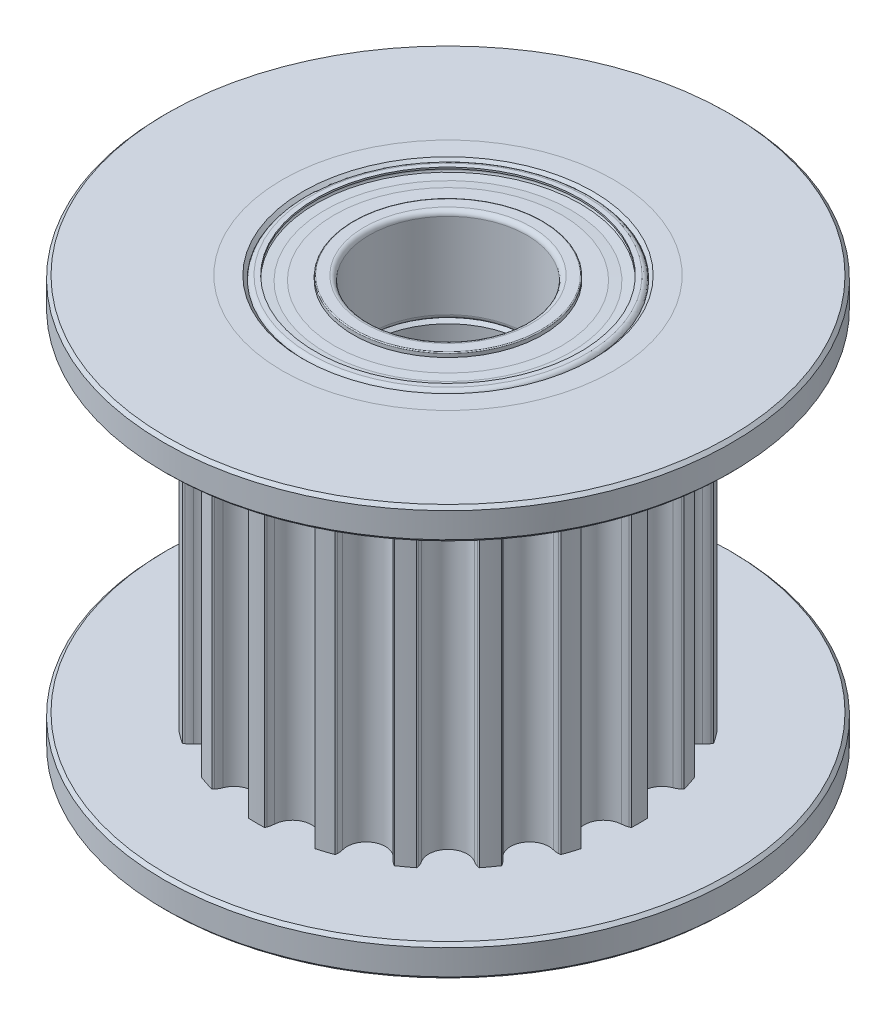
from build123d import *

# Parameters (mm, degrees)
ZKOSEN_1_SIZE            = 0.1
ZAOBLIT1_R               = 0.1
SKICA11_OUTSIDE_W        = 18.46
SKICA11_OUTSIDE_H        = 18.46
ODEBRAT_VYSUNUT_M1_DEPTH = 15.758429795
SKICA10_R                = 9
SKICA10_R_2              = 5.25
P_IDAT_VYSUNUT_M1_DEPTH  = 1
SKICA12_R                = 9
SKICA12_R_2              = 5.25
P_IDAT_VYSUNUT_M2_DEPTH  = 1
ZKOSEN_2_SIZE            = 0.1
ZKOSEN_3_SIZE            = 0.1
KRUHOV_POLE1_COUNT       = 8
KRUHOV_POLE3_COUNT       = 8


with BuildPart() as part:
    # Skica1 → Rotovat1 (revolve)
    with BuildSketch(Plane.XY, mode=Mode.PRIVATE) as rotovat1_sk:
        Polygon((4.5, 13), (5.25, 13), (5.25, 12), (6.075, 12), (6.075, 1), (5.25, 1), (5.25, 0), (4.5, 0), (4.5, 3), (2.5, 3), (2.5, 10), (4.5, 10), align=None)
    revolve(rotovat1_sk.sketch.rotate(Axis((0, 0, 0), (0, -1, 0)), 90), axis=Axis((0, 0, 0), (0, -1, 0)))

    # Zkosení1
    zkosen_1_edges = [part.edges().sort_by_distance(p)[0] for p in [
        (0, 3, -2.5),
        (0, 0, -4.5),
        (0, 13, -4.5),
        (0, 10, -2.5),
    ]]
    chamfer(zkosen_1_edges, length=ZKOSEN_1_SIZE)

    # Zaoblit1
    zaoblit1_edges = [part.edges().sort_by_distance(p)[0] for p in [
        (0, 3, -4.5),
        (0, 10, -4.5),
    ]]
    fillet(zaoblit1_edges, radius=ZAOBLIT1_R)

    # Skica11 outside → Odebrat vysunutím1 (cut, through all)
    with BuildSketch(Plane(origin=(0, 12, 0), x_dir=(1, 0, 0), z_dir=(0, 1, 0))):
        Rectangle(SKICA11_OUTSIDE_W, SKICA11_OUTSIDE_H)
        with BuildLine():
            ThreePointArc((-3.682382953, -4.525571141), (-3.762727315, -3.762727315), (-4.525571141, -3.682382953))
            ThreePointArc((-4.525571141, -3.682382953), (-4.610021183, -3.728793285), (-4.700326133, -3.762419831))
            ThreePointArc((-4.700326133, -3.762419831), (-4.754288274, -3.771323603), (-4.808820948, -3.767154999))
            ThreePointArc((-4.808820948, -3.767154999), (-4.942042114, -3.590603771), (-5.068784705, -3.409345583))
            ThreePointArc((-5.068784705, -3.409345583), (-5.05589776, -3.356193758), (-5.030754552, -3.307624129))
            ThreePointArc((-5.030754552, -3.307624129), (-4.970868041, -3.232130193), (-4.900632695, -3.166155011))
            ThreePointArc((-4.900632695, -3.166155011), (-4.741313017, -2.415819646), (-5.441992836, -2.103675911))
            ThreePointArc((-5.441992836, -2.103675911), (-5.53665118, -2.121718261), (-5.632927465, -2.125793243))
            ThreePointArc((-5.632927465, -2.125793243), (-5.686999927, -2.117586015), (-5.737575413, -2.096769914))
            ThreePointArc((-5.737575413, -2.096769914), (-5.809718941, -1.887692114), (-5.874246448, -1.676139718))
            ThreePointArc((-5.874246448, -1.676139718), (-5.845565418, -1.629571614), (-5.806643965, -1.591148831))
            ThreePointArc((-5.806643965, -1.591148831), (-5.7263596, -1.53785578), (-5.639174364, -1.496813569))
            ThreePointArc((-5.639174364, -1.496813569), (-5.255785967, -0.832434719), (-5.825714356, -0.319046414))
            ThreePointArc((-5.825714356, -0.319046414), (-5.921315183, -0.306954671), (-6.01413861, -0.281079202))
            ThreePointArc((-6.01413861, -0.281079202), (-6.063028405, -0.256564354), (-6.104696021, -0.221138381))
            ThreePointArc((-6.104696021, -0.221138381), (-6.1087, 0), (-6.104696021, 0.221138381))
            ThreePointArc((-6.104696021, 0.221138381), (-6.063028405, 0.256564354), (-6.01413861, 0.281079202))
            ThreePointArc((-6.01413861, 0.281079202), (-5.921315183, 0.306954671), (-5.825714356, 0.319046414))
            ThreePointArc((-5.825714356, 0.319046414), (-5.255785967, 0.832434719), (-5.639174364, 1.496813569))
            ThreePointArc((-5.639174364, 1.496813569), (-5.7263596, 1.53785578), (-5.806643965, 1.591148831))
            ThreePointArc((-5.806643965, 1.591148831), (-5.845565418, 1.629571614), (-5.874246448, 1.676139718))
            ThreePointArc((-5.874246448, 1.676139718), (-5.809718941, 1.887692114), (-5.737575413, 2.096769914))
            ThreePointArc((-5.737575413, 2.096769914), (-5.686999927, 2.117586015), (-5.632927465, 2.125793243))
            ThreePointArc((-5.632927465, 2.125793243), (-5.53665118, 2.121718261), (-5.441992836, 2.103675911))
            ThreePointArc((-5.441992836, 2.103675911), (-4.741313017, 2.415819646), (-4.900632695, 3.166155011))
            ThreePointArc((-4.900632695, 3.166155011), (-4.970868041, 3.232130193), (-5.030754552, 3.307624129))
            ThreePointArc((-5.030754552, 3.307624129), (-5.05589776, 3.356193758), (-5.068784705, 3.409345583))
            ThreePointArc((-5.068784705, 3.409345583), (-4.942042114, 3.590603771), (-4.808820948, 3.767154999))
            ThreePointArc((-4.808820948, 3.767154999), (-4.754288274, 3.771323603), (-4.700326133, 3.762419831))
            ThreePointArc((-4.700326133, 3.762419831), (-4.610021183, 3.728793285), (-4.525571141, 3.682382953))
            ThreePointArc((-4.525571141, 3.682382953), (-3.762727315, 3.762727315), (-3.682382953, 4.525571141))
            ThreePointArc((-3.682382953, 4.525571141), (-3.728793285, 4.610021183), (-3.762419831, 4.700326133))
            ThreePointArc((-3.762419831, 4.700326133), (-3.771323603, 4.754288274), (-3.767154999, 4.808820948))
            ThreePointArc((-3.767154999, 4.808820948), (-3.590603771, 4.942042114), (-3.409345583, 5.068784705))
            ThreePointArc((-3.409345583, 5.068784705), (-3.356193758, 5.05589776), (-3.307624129, 5.030754552))
            ThreePointArc((-3.307624129, 5.030754552), (-3.232130193, 4.970868041), (-3.166155011, 4.900632695))
            ThreePointArc((-3.166155011, 4.900632695), (-2.415819646, 4.741313017), (-2.103675911, 5.441992836))
            ThreePointArc((-2.103675911, 5.441992836), (-2.121718261, 5.53665118), (-2.125793243, 5.632927465))
            ThreePointArc((-2.125793243, 5.632927465), (-2.117586015, 5.686999927), (-2.096769914, 5.737575413))
            ThreePointArc((-2.096769914, 5.737575413), (-1.887692114, 5.809718941), (-1.676139718, 5.874246448))
            ThreePointArc((-1.676139718, 5.874246448), (-1.629571614, 5.845565418), (-1.591148831, 5.806643965))
            ThreePointArc((-1.591148831, 5.806643965), (-1.53785578, 5.7263596), (-1.496813569, 5.639174364))
            ThreePointArc((-1.496813569, 5.639174364), (-0.832434719, 5.255785967), (-0.319046414, 5.825714356))
            ThreePointArc((-0.319046414, 5.825714356), (-0.306954671, 5.921315183), (-0.281079202, 6.01413861))
            ThreePointArc((-0.281079202, 6.01413861), (-0.256564354, 6.063028405), (-0.221138381, 6.104696021))
            ThreePointArc((-0.221138381, 6.104696021), (0, 6.1087), (0.221138381, 6.104696021))
            ThreePointArc((0.221138381, 6.104696021), (0.256564354, 6.063028405), (0.281079202, 6.01413861))
            ThreePointArc((0.281079202, 6.01413861), (0.306954671, 5.921315183), (0.319046414, 5.825714356))
            ThreePointArc((0.319046414, 5.825714356), (0.832434719, 5.255785967), (1.496813569, 5.639174364))
            ThreePointArc((1.496813569, 5.639174364), (1.53785578, 5.7263596), (1.591148831, 5.806643965))
            ThreePointArc((1.591148831, 5.806643965), (1.629571614, 5.845565418), (1.676139718, 5.874246448))
            ThreePointArc((1.676139718, 5.874246448), (1.887692114, 5.809718941), (2.096769914, 5.737575413))
            ThreePointArc((2.096769914, 5.737575413), (2.117586015, 5.686999927), (2.125793243, 5.632927465))
            ThreePointArc((2.125793243, 5.632927465), (2.121718261, 5.53665118), (2.103675911, 5.441992836))
            ThreePointArc((2.103675911, 5.441992836), (2.415819646, 4.741313017), (3.166155011, 4.900632695))
            ThreePointArc((3.166155011, 4.900632695), (3.232130193, 4.970868041), (3.307624129, 5.030754552))
            ThreePointArc((3.307624129, 5.030754552), (3.356193758, 5.05589776), (3.409345583, 5.068784705))
            ThreePointArc((3.409345583, 5.068784705), (3.590603771, 4.942042114), (3.767154999, 4.808820948))
            ThreePointArc((3.767154999, 4.808820948), (3.771323603, 4.754288274), (3.762419831, 4.700326133))
            ThreePointArc((3.762419831, 4.700326133), (3.728793285, 4.610021183), (3.682382953, 4.525571141))
            ThreePointArc((3.682382953, 4.525571141), (3.762727315, 3.762727315), (4.525571141, 3.682382953))
            ThreePointArc((4.525571141, 3.682382953), (4.610021183, 3.728793285), (4.700326133, 3.762419831))
            ThreePointArc((4.700326133, 3.762419831), (4.754288273, 3.771323603), (4.808820948, 3.767154999))
            ThreePointArc((4.808820948, 3.767154999), (4.942042114, 3.590603771), (5.068784705, 3.409345583))
            ThreePointArc((5.068784705, 3.409345583), (5.05589776, 3.356193758), (5.030754552, 3.307624129))
            ThreePointArc((5.030754552, 3.307624129), (4.970868041, 3.232130193), (4.900632695, 3.166155011))
            ThreePointArc((4.900632695, 3.166155011), (4.741313017, 2.415819646), (5.441992836, 2.103675911))
            ThreePointArc((5.441992836, 2.103675911), (5.53665118, 2.121718261), (5.632927465, 2.125793243))
            ThreePointArc((5.632927465, 2.125793243), (5.686999927, 2.117586015), (5.737575413, 2.096769914))
            ThreePointArc((5.737575413, 2.096769914), (5.809718941, 1.887692114), (5.874246448, 1.676139718))
            ThreePointArc((5.874246448, 1.676139718), (5.845565418, 1.629571614), (5.806643965, 1.591148831))
            ThreePointArc((5.806643965, 1.591148831), (5.7263596, 1.53785578), (5.639174364, 1.496813569))
            ThreePointArc((5.639174364, 1.496813569), (5.255785967, 0.832434719), (5.825714356, 0.319046414))
            ThreePointArc((5.825714356, 0.319046414), (5.921315183, 0.306954671), (6.01413861, 0.281079202))
            ThreePointArc((6.01413861, 0.281079202), (6.063028405, 0.256564354), (6.104696021, 0.221138381))
            ThreePointArc((6.104696021, 0.221138381), (6.1087, 0), (6.104696021, -0.221138381))
            ThreePointArc((6.104696021, -0.221138381), (6.063028405, -0.256564354), (6.01413861, -0.281079202))
            ThreePointArc((6.01413861, -0.281079202), (5.921315183, -0.306954671), (5.825714356, -0.319046414))
            ThreePointArc((5.825714356, -0.319046414), (5.255785967, -0.832434719), (5.639174364, -1.496813569))
            ThreePointArc((5.639174364, -1.496813569), (5.7263596, -1.53785578), (5.806643965, -1.591148831))
            ThreePointArc((5.806643965, -1.591148831), (5.845565418, -1.629571614), (5.874246448, -1.676139718))
            ThreePointArc((5.874246448, -1.676139718), (5.809718941, -1.887692114), (5.737575413, -2.096769914))
            ThreePointArc((5.737575413, -2.096769914), (5.686999927, -2.117586015), (5.632927465, -2.125793243))
            ThreePointArc((5.632927465, -2.125793243), (5.53665118, -2.121718261), (5.441992836, -2.103675911))
            ThreePointArc((5.441992836, -2.103675911), (4.741313017, -2.415819646), (4.900632695, -3.166155011))
            ThreePointArc((4.900632695, -3.166155011), (4.970868041, -3.232130193), (5.030754552, -3.307624129))
            ThreePointArc((5.030754552, -3.307624129), (5.05589776, -3.356193758), (5.068784705, -3.409345583))
            ThreePointArc((5.068784705, -3.409345583), (4.942042114, -3.590603771), (4.808820948, -3.767154999))
            ThreePointArc((4.808820948, -3.767154999), (4.754288273, -3.771323603), (4.700326133, -3.762419831))
            ThreePointArc((4.700326133, -3.762419831), (4.610021183, -3.728793285), (4.525571141, -3.682382953))
            ThreePointArc((4.525571141, -3.682382953), (3.762727315, -3.762727315), (3.682382953, -4.525571141))
            ThreePointArc((3.682382953, -4.525571141), (3.728793285, -4.610021183), (3.762419831, -4.700326133))
            ThreePointArc((3.762419831, -4.700326133), (3.771323603, -4.754288274), (3.767154999, -4.808820948))
            ThreePointArc((3.767154999, -4.808820948), (3.590603771, -4.942042114), (3.409345583, -5.068784705))
            ThreePointArc((3.409345583, -5.068784705), (3.356193758, -5.05589776), (3.307624129, -5.030754552))
            ThreePointArc((3.307624129, -5.030754552), (3.232130193, -4.970868041), (3.166155011, -4.900632695))
            ThreePointArc((3.166155011, -4.900632695), (2.415819646, -4.741313017), (2.103675911, -5.441992836))
            ThreePointArc((2.103675911, -5.441992836), (2.121718261, -5.53665118), (2.125793243, -5.632927465))
            ThreePointArc((2.125793243, -5.632927465), (2.117586015, -5.686999927), (2.096769914, -5.737575413))
            ThreePointArc((2.096769914, -5.737575413), (1.887692114, -5.809718941), (1.676139718, -5.874246448))
            ThreePointArc((1.676139718, -5.874246448), (1.629571614, -5.845565418), (1.591148831, -5.806643965))
            ThreePointArc((1.591148831, -5.806643965), (1.53785578, -5.7263596), (1.496813569, -5.639174364))
            ThreePointArc((1.496813569, -5.639174364), (0.832434719, -5.255785967), (0.319046414, -5.825714356))
            ThreePointArc((0.319046414, -5.825714356), (0.306954671, -5.921315183), (0.281079202, -6.01413861))
            ThreePointArc((0.281079202, -6.01413861), (0.256564354, -6.063028405), (0.221138381, -6.104696021))
            ThreePointArc((0.221138381, -6.104696021), (0, -6.1087), (-0.221138381, -6.104696021))
            ThreePointArc((-0.221138381, -6.104696021), (-0.256564354, -6.063028405), (-0.281079202, -6.01413861))
            ThreePointArc((-0.281079202, -6.01413861), (-0.306954671, -5.921315183), (-0.319046414, -5.825714356))
            ThreePointArc((-0.319046414, -5.825714356), (-0.832434719, -5.255785967), (-1.496813569, -5.639174364))
            ThreePointArc((-1.496813569, -5.639174364), (-1.53785578, -5.7263596), (-1.591148831, -5.806643965))
            ThreePointArc((-1.591148831, -5.806643965), (-1.629571614, -5.845565418), (-1.676139718, -5.874246448))
            ThreePointArc((-1.676139718, -5.874246448), (-1.887692114, -5.809718941), (-2.096769914, -5.737575413))
            ThreePointArc((-2.096769914, -5.737575413), (-2.117586015, -5.686999927), (-2.125793243, -5.632927465))
            ThreePointArc((-2.125793243, -5.632927465), (-2.121718261, -5.53665118), (-2.103675911, -5.441992836))
            ThreePointArc((-2.103675911, -5.441992836), (-2.415819646, -4.741313017), (-3.166155011, -4.900632695))
            ThreePointArc((-3.166155011, -4.900632695), (-3.232130193, -4.970868041), (-3.307624129, -5.030754552))
            ThreePointArc((-3.307624129, -5.030754552), (-3.356193758, -5.05589776), (-3.409345583, -5.068784705))
            ThreePointArc((-3.409345583, -5.068784705), (-3.590603771, -4.942042114), (-3.767154999, -4.808820948))
            ThreePointArc((-3.767154999, -4.808820948), (-3.771323603, -4.754288274), (-3.762419831, -4.700326133))
            ThreePointArc((-3.762419831, -4.700326133), (-3.728793285, -4.610021183), (-3.682382953, -4.525571141))
        make_face(mode=Mode.SUBTRACT)
    extrude(amount=-ODEBRAT_VYSUNUT_M1_DEPTH, mode=Mode.SUBTRACT)


with BuildPart() as body_2:
    # Skica10 → Přidat vysunutím1 (new body)
    with BuildSketch(Plane(origin=(0, 13, 0), x_dir=(1, 0, 0), z_dir=(0, 1, 0))):
        with Locations(Location((0, 0, 0), (0, 0, 270))):
            Circle(SKICA10_R)
        with Locations(Location((0, 0, 0), (0, 0, 270))):
            Circle(SKICA10_R_2, mode=Mode.SUBTRACT)
    extrude(amount=-P_IDAT_VYSUNUT_M1_DEPTH)

    # Zkosení2
    zkosen_2_edges = [body_2.edges().sort_by_distance(p)[0] for p in [
        (0, 13, -9),
        (0, 12, -9),
    ]]
    chamfer(zkosen_2_edges, length=ZKOSEN_2_SIZE)


with BuildPart() as body_3:
    # Skica12 → Přidat vysunutím2 (new body)
    with BuildSketch(Plane.XZ):
        with Locations(Location((0, 0, 0), (0, 0, 270))):
            Circle(SKICA12_R)
        with Locations(Location((0, 0, 0), (0, 0, 270))):
            Circle(SKICA12_R_2, mode=Mode.SUBTRACT)
    extrude(amount=-P_IDAT_VYSUNUT_M2_DEPTH)

    # Zkosení3
    zkosen_3_edges = [body_3.edges().sort_by_distance(p)[0] for p in [
        (0, 0, 9),
        (0, 1, 9),
    ]]
    chamfer(zkosen_3_edges, length=ZKOSEN_3_SIZE)


with BuildPart() as body_4:
    # Skica4 → Rotovat2 (revolve)
    with BuildSketch(Plane.XY, mode=Mode.PRIVATE) as rotovat2_sk:
        with BuildLine():
            Line((4.5, 12.85), (4.5, 10.15))
            ThreePointArc((4.5, 10.15), (4.456066017, 10.043933983), (4.35, 10))
            Line((4.35, 10), (4.2, 10))
            Line((4.2, 10), (4.2, 10.05))
            ThreePointArc((4.2, 10.05), (4.289757174, 10.133393211), (4.213177928, 10.229030007))
            Line((4.213177928, 10.229030007), (3.85, 10.282786405))
            Line((3.85, 10.282786405), (3.85, 11.052786405))
            ThreePointArc((3.85, 11.052786405), (4.05, 11.5), (3.85, 11.947213595))
            Line((3.85, 11.947213595), (3.85, 12.717213595))
            Line((3.85, 12.717213595), (4.213177928, 12.770969993))
            ThreePointArc((4.213177928, 12.770969993), (4.289757174, 12.866606789), (4.2, 12.95))
            Line((4.2, 12.95), (4.2, 13))
            Line((4.2, 13), (4.35, 13))
            ThreePointArc((4.35, 13), (4.456066017, 12.956066017), (4.5, 12.85))
        make_face()
    revolve(rotovat2_sk.sketch.rotate(Axis((0, 0, 0), (0, 1, 0)), 90), axis=Axis((0, 0, 0), (0, 1, 0)))


with BuildPart() as body_5:
    # Skica5 → Rotovat3 (revolve)
    with BuildSketch(Plane.XY, mode=Mode.PRIVATE) as rotovat3_sk:
        with BuildLine():
            Line((2.5, 12.85), (2.5, 10.15))
            ThreePointArc((2.5, 10.15), (2.543933983, 10.043933983), (2.65, 10))
            Line((2.65, 10), (2.97, 10))
            ThreePointArc((2.97, 10), (2.991213203, 10.008786797), (3, 10.03))
            Line((3, 10.03), (3, 10.14))
            Line((3, 10.14), (3.6, 10.14))
            Line((3.6, 10.14), (3.896185034, 10.191714847))
            Line((3.896185034, 10.191714847), (4.192370069, 10.14))
            Line((4.192370069, 10.14), (4.192370069, 10.19))
            Line((4.192370069, 10.19), (3.897467562, 10.258062558))
            Line((3.897467562, 10.258062558), (3.597467562, 10.258062558))
            Line((3.597467562, 10.258062558), (3, 10.19))
            Line((3, 10.19), (3, 11.103137303))
            ThreePointArc((3, 11.103137303), (2.85, 11.5), (3, 11.896862697))
            Line((3, 11.896862697), (3, 12.81))
            Line((3, 12.81), (3.6, 12.77))
            Line((3.6, 12.77), (3.9, 12.77))
            Line((3.9, 12.77), (4.2, 12.81))
            Line((4.2, 12.81), (4.2, 12.86))
            Line((4.2, 12.86), (3.9, 12.84))
            Line((3.9, 12.84), (3.6, 12.86))
            Line((3.6, 12.86), (3, 12.86))
            Line((3, 12.86), (3, 12.97))
            ThreePointArc((3, 12.97), (2.991213203, 12.991213203), (2.97, 13))
            Line((2.97, 13), (2.65, 13))
            ThreePointArc((2.65, 13), (2.543933983, 12.956066017), (2.5, 12.85))
        make_face()
    revolve(rotovat3_sk.sketch.rotate(Axis((0, 0, 0), (0, 1, 0)), 90), axis=Axis((0, 0, 0), (0, 1, 0)))


with BuildPart() as body_6:
    # Skica6 → Rotovat4 (revolve)
    with BuildSketch(Plane.XY):
        with BuildLine():
            Line((3.45, 12.1), (3.45, 10.9))
            ThreePointArc((3.45, 10.9), (4.05, 11.5), (3.45, 12.1))
        make_face()
    revolve(axis=Axis((3.45, 12.1, 0), (0, -1, 0)))


with BuildPart() as kruhov_pole1_1:
    # Kruhové pole1: pattern copy
    add(body_6.part.rotate(Axis((0, 0, 0), (0, 1, 0)), 1 * 360 / KRUHOV_POLE1_COUNT))


with BuildPart() as kruhov_pole1_2:
    # Kruhové pole1: pattern copy
    add(body_6.part.rotate(Axis((0, 0, 0), (0, 1, 0)), 2 * 360 / KRUHOV_POLE1_COUNT))


with BuildPart() as kruhov_pole1_3:
    # Kruhové pole1: pattern copy
    add(body_6.part.rotate(Axis((0, 0, 0), (0, 1, 0)), 3 * 360 / KRUHOV_POLE1_COUNT))


with BuildPart() as kruhov_pole1_4:
    # Kruhové pole1: pattern copy
    add(body_6.part.rotate(Axis((0, 0, 0), (0, 1, 0)), 4 * 360 / KRUHOV_POLE1_COUNT))


with BuildPart() as kruhov_pole1_5:
    # Kruhové pole1: pattern copy
    add(body_6.part.rotate(Axis((0, 0, 0), (0, 1, 0)), 5 * 360 / KRUHOV_POLE1_COUNT))


with BuildPart() as kruhov_pole1_6:
    # Kruhové pole1: pattern copy
    add(body_6.part.rotate(Axis((0, 0, 0), (0, 1, 0)), 6 * 360 / KRUHOV_POLE1_COUNT))


with BuildPart() as kruhov_pole1_7:
    # Kruhové pole1: pattern copy
    add(body_6.part.rotate(Axis((0, 0, 0), (0, 1, 0)), 7 * 360 / KRUHOV_POLE1_COUNT))


with BuildPart() as body_14:
    # Skica7 → Rotovat5 (revolve)
    with BuildSketch(Plane.XY, mode=Mode.PRIVATE) as rotovat5_sk:
        with BuildLine():
            Line((4.5, 2.85), (4.5, 0.15))
            ThreePointArc((4.5, 0.15), (4.456066017, 0.043933983), (4.35, 0))
            Line((4.35, 0), (4.2, 0))
            Line((4.2, 0), (4.2, 0.05))
            ThreePointArc((4.2, 0.05), (4.289757174, 0.133393211), (4.213177928, 0.229030007))
            Line((4.213177928, 0.229030007), (3.85, 0.282786405))
            Line((3.85, 0.282786405), (3.85, 1.052786405))
            ThreePointArc((3.85, 1.052786405), (4.05, 1.5), (3.85, 1.947213595))
            Line((3.85, 1.947213595), (3.85, 2.717213595))
            Line((3.85, 2.717213595), (4.213177928, 2.770969993))
            ThreePointArc((4.213177928, 2.770969993), (4.289757174, 2.866606789), (4.2, 2.95))
            Line((4.2, 2.95), (4.2, 3))
            Line((4.2, 3), (4.35, 3))
            ThreePointArc((4.35, 3), (4.456066017, 2.956066017), (4.5, 2.85))
        make_face()
    revolve(rotovat5_sk.sketch.rotate(Axis((0, 0, 0), (0, 1, 0)), 90), axis=Axis((0, 0, 0), (0, 1, 0)))


with BuildPart() as body_15:
    # Skica8 → Rotovat6 (revolve)
    with BuildSketch(Plane.XY, mode=Mode.PRIVATE) as rotovat6_sk:
        with BuildLine():
            Line((2.5, 2.85), (2.5, 0.15))
            ThreePointArc((2.5, 0.15), (2.543933983, 0.043933983), (2.65, 0))
            Line((2.65, 0), (2.97, 0))
            ThreePointArc((2.97, 0), (2.991213203, 0.008786797), (3, 0.03))
            Line((3, 0.03), (3, 0.14))
            Line((3, 0.14), (3.6, 0.14))
            Line((3.6, 0.14), (3.896185034, 0.191714847))
            Line((3.896185034, 0.191714847), (4.192370069, 0.14))
            Line((4.192370069, 0.14), (4.192370069, 0.19))
            Line((4.192370069, 0.19), (3.897467562, 0.258062558))
            Line((3.897467562, 0.258062558), (3.597467562, 0.258062558))
            Line((3.597467562, 0.258062558), (3, 0.19))
            Line((3, 0.19), (3, 1.103137303))
            ThreePointArc((3, 1.103137303), (2.85, 1.5), (3, 1.896862697))
            Line((3, 1.896862697), (3, 2.81))
            Line((3, 2.81), (3.6, 2.77))
            Line((3.6, 2.77), (3.9, 2.77))
            Line((3.9, 2.77), (4.2, 2.81))
            Line((4.2, 2.81), (4.2, 2.86))
            Line((4.2, 2.86), (3.9, 2.84))
            Line((3.9, 2.84), (3.6, 2.86))
            Line((3.6, 2.86), (3, 2.86))
            Line((3, 2.86), (3, 2.97))
            ThreePointArc((3, 2.97), (2.991213203, 2.991213203), (2.97, 3))
            Line((2.97, 3), (2.65, 3))
            ThreePointArc((2.65, 3), (2.543933983, 2.956066017), (2.5, 2.85))
        make_face()
    revolve(rotovat6_sk.sketch.rotate(Axis((0, 0, 0), (0, -1, 0)), 180), axis=Axis((0, 0, 0), (0, -1, 0)))


with BuildPart() as body_16:
    # Skica9 → Rotovat7 (revolve)
    with BuildSketch(Plane.XY):
        with BuildLine():
            Line((3.45, 2.1), (3.45, 0.9))
            ThreePointArc((3.45, 0.9), (4.05, 1.5), (3.45, 2.1))
        make_face()
    revolve(axis=Axis((3.45, 2.1, 0), (0, -1, 0)))


with BuildPart() as kruhov_pole3_1:
    # Kruhové pole3: pattern copy
    add(body_16.part.rotate(Axis((0, 0, 0), (0, 1, 0)), 1 * 360 / KRUHOV_POLE3_COUNT))


with BuildPart() as kruhov_pole3_2:
    # Kruhové pole3: pattern copy
    add(body_16.part.rotate(Axis((0, 0, 0), (0, 1, 0)), 2 * 360 / KRUHOV_POLE3_COUNT))


with BuildPart() as kruhov_pole3_3:
    # Kruhové pole3: pattern copy
    add(body_16.part.rotate(Axis((0, 0, 0), (0, 1, 0)), 3 * 360 / KRUHOV_POLE3_COUNT))


with BuildPart() as kruhov_pole3_4:
    # Kruhové pole3: pattern copy
    add(body_16.part.rotate(Axis((0, 0, 0), (0, 1, 0)), 4 * 360 / KRUHOV_POLE3_COUNT))


with BuildPart() as kruhov_pole3_5:
    # Kruhové pole3: pattern copy
    add(body_16.part.rotate(Axis((0, 0, 0), (0, 1, 0)), 5 * 360 / KRUHOV_POLE3_COUNT))


with BuildPart() as kruhov_pole3_6:
    # Kruhové pole3: pattern copy
    add(body_16.part.rotate(Axis((0, 0, 0), (0, 1, 0)), 6 * 360 / KRUHOV_POLE3_COUNT))


with BuildPart() as kruhov_pole3_7:
    # Kruhové pole3: pattern copy
    add(body_16.part.rotate(Axis((0, 0, 0), (0, 1, 0)), 7 * 360 / KRUHOV_POLE3_COUNT))


solid = Compound([part.part, body_2.part, body_3.part, body_4.part, body_5.part, body_6.part, kruhov_pole1_1.part, kruhov_pole1_2.part, kruhov_pole1_3.part, kruhov_pole1_4.part, kruhov_pole1_5.part, kruhov_pole1_6.part, kruhov_pole1_7.part, body_14.part, body_15.part, body_16.part, kruhov_pole3_1.part, kruhov_pole3_2.part, kruhov_pole3_3.part, kruhov_pole3_4.part, kruhov_pole3_5.part, kruhov_pole3_6.part, kruhov_pole3_7.part])
